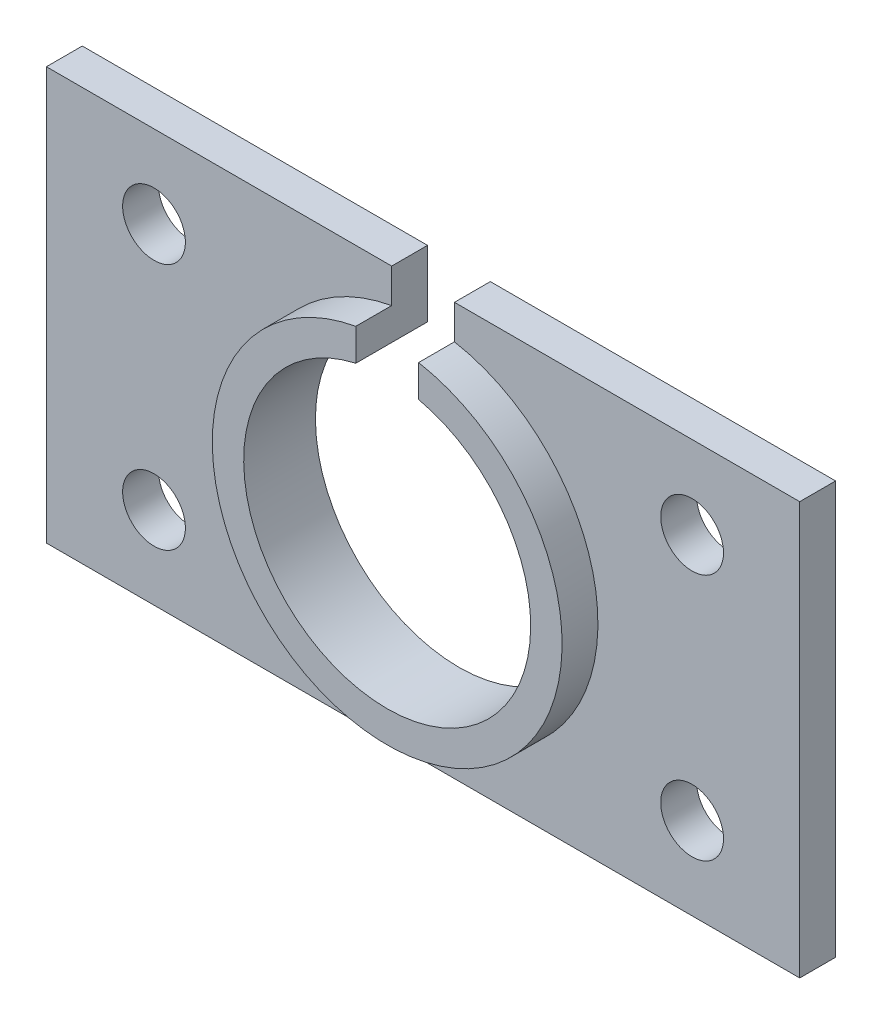
from build123d import *

# Parameters (mm, degrees)
SKETCH_2_W               = 42
SKETCH_2_H               = 23
EXTRUDE_1_DEPTH          = 2
SKETCH_3_R               = 9.75
EXTRUDE_2_DEPTH          = 2
SKETCH_4_R               = 8
CUT_EXTRUDE_1_DEPTH      = 69.058798109
CUT_EXTRUDE_2_DEPTH      = 69.058798109
CUT_EXTRUDE_2_DEPTH_BACK = 69.058798109
SKETCH_5_R               = 1.75
CUT_EXTRUDE_4_REACH      = 70.059
SKETCH_7_W               = 3.5
SKETCH_7_H               = 14.451393072


with BuildPart() as part:
    # 草图2 → 凸台-拉伸1 (new body)
    with BuildSketch(Plane.XY):
        with Locations((25, 38.5)):
            Rectangle(SKETCH_2_W, SKETCH_2_H)
    extrude(amount=EXTRUDE_1_DEPTH)

    # 草图3 → 凸台-拉伸2 (add)
    with BuildSketch(Plane.XY.offset(2)):
        with Locations((25, 38.5)):
            Circle(SKETCH_3_R)
    extrude(amount=EXTRUDE_2_DEPTH)

    # 草图4 → 切除-拉伸1 (cut, through all)
    with BuildSketch(Plane.XY.offset(4)):
        with Locations((25, 38.5)):
            Circle(SKETCH_4_R)
    extrude(amount=-CUT_EXTRUDE_1_DEPTH, mode=Mode.SUBTRACT)

    # 草图5 → 切除-拉伸2 (cut, two sides: drawn at the far end of the back side and taken through both)
    with BuildSketch(Plane(origin=(0, 0, 0), x_dir=(-1, 0, 0), z_dir=(0, 0, -1)).offset(-CUT_EXTRUDE_2_DEPTH_BACK)):
        with Locations(Location((-40, 45.4, 0), (0, 0, 180))):
            Circle(SKETCH_5_R)
        with Locations(Location((-40, 31.6, 0), (0, 0, 180))):
            Circle(SKETCH_5_R)
        with Locations(Location((-10, 31.6, 0), (0, 0, 180))):
            Circle(SKETCH_5_R)
        with Locations(Location((-10, 45.4, 0), (0, 0, 180))):
            Circle(SKETCH_5_R)
    extrude(amount=CUT_EXTRUDE_2_DEPTH + CUT_EXTRUDE_2_DEPTH_BACK, mode=Mode.SUBTRACT)

    # 草图7 → 切除-拉伸4 (cut, up to next)
    with BuildSketch(Plane(origin=(0, 0, 0), x_dir=(-1, 0, 0), z_dir=(0, 0, -1)), mode=Mode.PRIVATE) as cut_extrude_4_sk1:
        with Locations((-25, 46.889165471)):
            Rectangle(SKETCH_7_W, SKETCH_7_H)
    cut_extrude_4_tool1 = extrude(cut_extrude_4_sk1.sketch, amount=-CUT_EXTRUDE_4_REACH, mode=Mode.PRIVATE) & part.part
    add(cut_extrude_4_tool1.solids().sort_by_distance((25, 46.889165, 0))[0], mode=Mode.SUBTRACT)


solid = part.part
